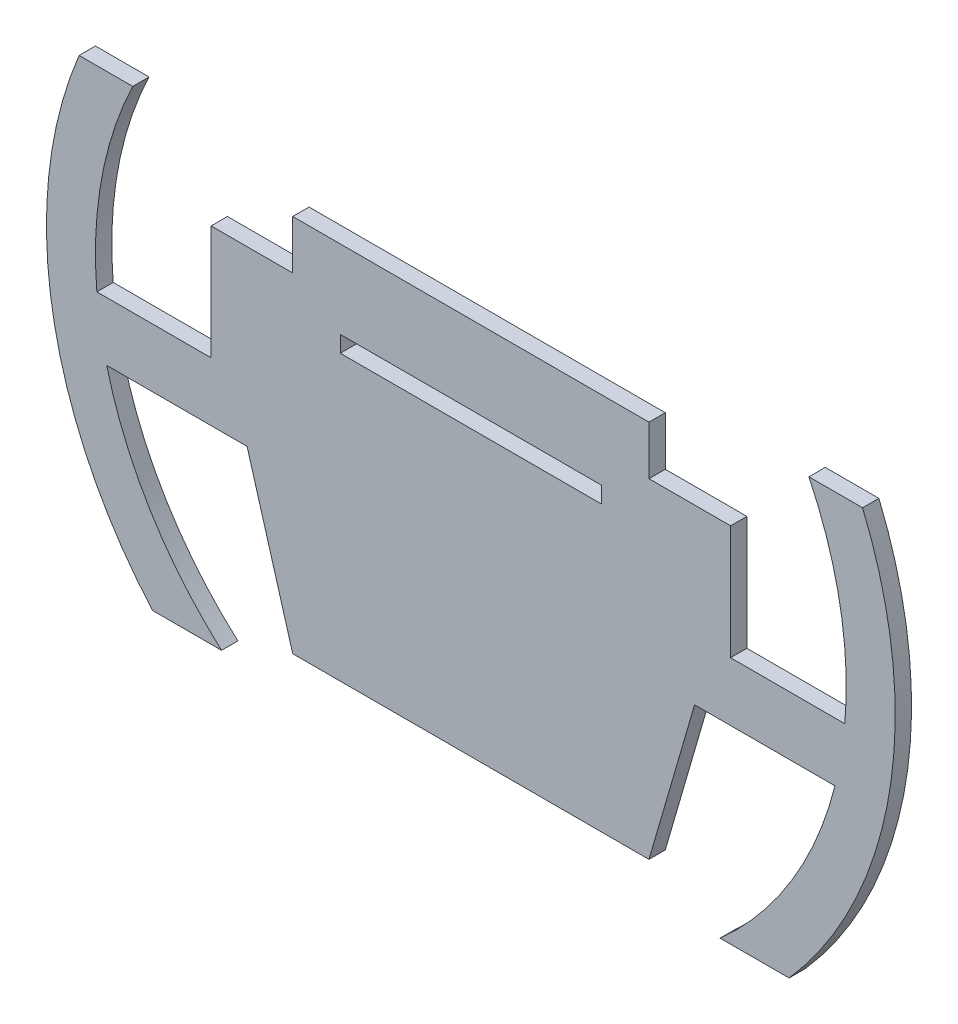
from build123d import *

# Parameters (mm, degrees)
BOSS_EXTRU_1_DEPTH      = 5
ENL_V_MAT_EXTRU_1_DEPTH = 156.951915666
ENL_V_MAT_EXTRU_2_DEPTH = 156.951915666
ESQUISSE7_W             = 10
ESQUISSE7_H             = 42.449970018
ENL_V_MAT_EXTRU_5_DEPTH = 156.951915666
ESQUISSE8_W             = 80
ESQUISSE8_H             = 5
ENL_V_MAT_EXTRU_8_DEPTH = 5


with BuildPart() as part:
    # Esquisse1 → Boss.-Extru.1 (new body)
    with BuildSketch(Plane.XY):
        with BuildLine():
            ThreePointArc((-111.539230767, -28), (-98.317812976, -59.654066514), (-76.347887987, -86))
            Line((-76.347887987, -86), (-97.488460856, -86))
            ThreePointArc((-97.488460856, -86), (-128.254854299, -21.229515978), (-120, 50))
            Line((-120, 50), (-103.561575886, 50))
            ThreePointArc((-103.561575886, 50), (-113.113812186, 20.742841962), (-114.564392374, -10))
            Line((-114.564392374, -10), (-89.564392374, -10))
            Line((-89.564392374, -10), (-89.564392374, 25))
            Line((-89.564392374, 25), (-54.564392374, 25))
            Line((-54.564392374, 25), (-54.564392374, 40))
            Line((-54.564392374, 40), (54.564392374, 40))
            Line((54.564392374, 40), (54.564392374, 25))
            Line((54.564392374, 25), (89.564392374, 25))
            Line((89.564392374, 25), (89.564392374, -10))
            Line((89.564392374, -10), (114.564392374, -10))
            ThreePointArc((114.564392374, -10), (113.113812186, 20.742841962), (103.561575886, 50))
            Line((103.561575886, 50), (120, 50))
            ThreePointArc((120, 50), (128.254854299, -21.229515978), (97.488460856, -86))
            Line((97.488460856, -86), (76.347887987, -86))
            ThreePointArc((76.347887987, -86), (98.317812976, -59.654066514), (111.539230767, -28))
            Line((111.539230767, -28), (68.539230767, -28))
            Line((68.539230767, -28), (54.564392374, -76))
            Line((54.564392374, -76), (-54.564392374, -76))
            Line((-54.564392374, -76), (-68.539230767, -28))
            Line((-68.539230767, -28), (-111.539230767, -28))
        make_face()
    extrude(amount=BOSS_EXTRU_1_DEPTH)

    # Esquisse3 → Enlèv. mat.-Extru.1 (cut, through all)
    with BuildSketch(Plane.XY.offset(5)):
        with BuildLine():
            Line((89.564392374, 25), (79.564392374, 25))
            ThreePointArc((79.564392374, 25), (86.635460186, 22.071067812), (89.564392374, 15))
            Line((89.564392374, 15), (89.564392374, 25))
        make_face()
    extrude(amount=-ENL_V_MAT_EXTRU_1_DEPTH, mode=Mode.SUBTRACT)

    # Esquisse6 → Enlèv. mat.-Extru.2 (cut, through all)
    with BuildSketch(Plane.XY.offset(5)):
        with BuildLine():
            ThreePointArc((-89.564392374, 15), (-86.635460186, 22.071067812), (-79.564392374, 25))
            Line((-79.564392374, 25), (-89.564392374, 25))
            Line((-89.564392374, 25), (-89.564392374, 15))
        make_face()
    extrude(amount=-ENL_V_MAT_EXTRU_2_DEPTH, mode=Mode.SUBTRACT)

    # Esquisse7 → Enlèv. mat.-Extru.5 (cut, through all)
    with BuildSketch(Plane.XY.offset(5)):
        with Locations((-84.564392374, 11.224985009)):
            Rectangle(ESQUISSE7_W, ESQUISSE7_H)
        with Locations((84.564392374, 11.224985009)):
            Rectangle(ESQUISSE7_W, ESQUISSE7_H)
    extrude(amount=-ENL_V_MAT_EXTRU_5_DEPTH, mode=Mode.SUBTRACT)

    # Esquisse8 → Enlèv. mat.-Extru.8 (cut)
    with BuildSketch(Plane.XY.offset(5)):
        with Locations((0, 13.5)):
            Rectangle(ESQUISSE8_W, ESQUISSE8_H)
    extrude(amount=-ENL_V_MAT_EXTRU_8_DEPTH, mode=Mode.SUBTRACT)


solid = part.part
